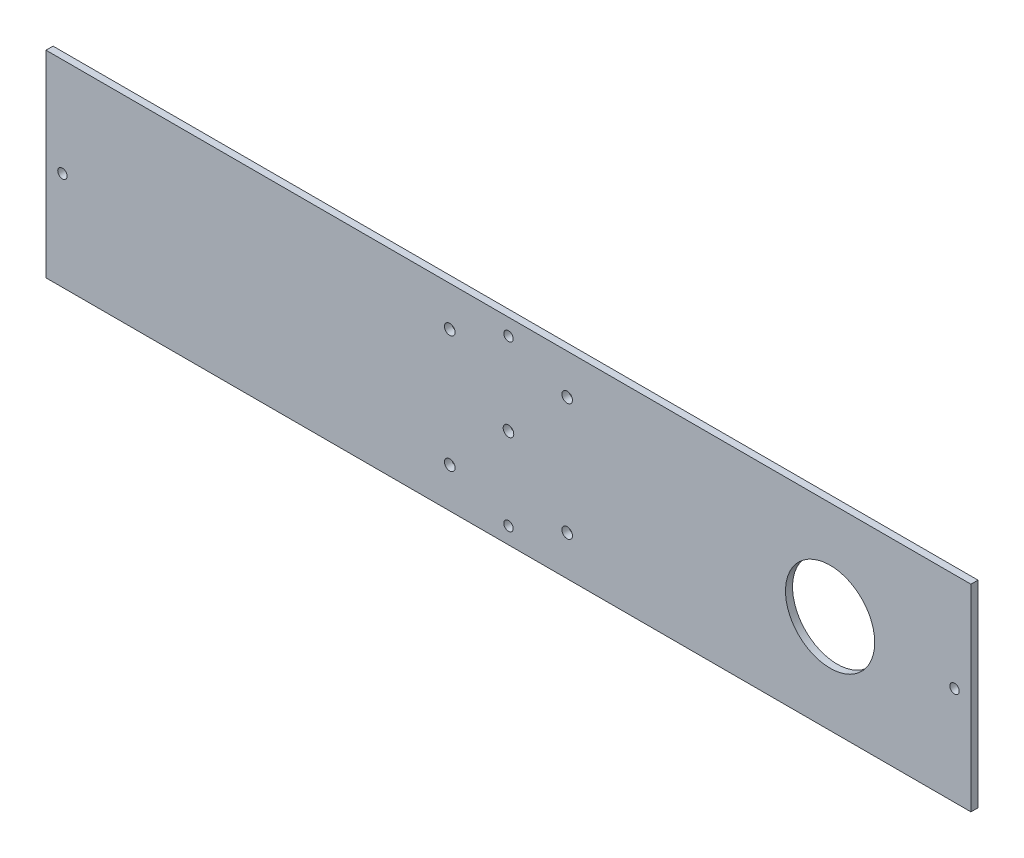
from build123d import *

# Parameters (mm, degrees)
SCHIZZO1_W                   = 394
SCHIZZO1_H                   = 84
SCHIZZO1_R                   = 2
SCHIZZO1_R_2                 = 2.25
SCHIZZO1_R_3                 = 19
ESTRUSIONE_ESTRUSIONE1_DEPTH = 3


with BuildPart() as part:
    # Schizzo1 → Estrusione-Estrusione1 (new body)
    with BuildSketch(Plane.XY):
        with Locations((197, 42)):
            Rectangle(SCHIZZO1_W, SCHIZZO1_H)
        with Locations((7, 42)):
            Circle(SCHIZZO1_R, mode=Mode.SUBTRACT)
        with Locations((197, 77)):
            Circle(SCHIZZO1_R, mode=Mode.SUBTRACT)
        with Locations((197, 7)):
            Circle(SCHIZZO1_R, mode=Mode.SUBTRACT)
        with Locations((387, 42)):
            Circle(SCHIZZO1_R, mode=Mode.SUBTRACT)
        with Locations((197, 42)):
            Circle(SCHIZZO1_R_2, mode=Mode.SUBTRACT)
        with Locations((172, 67)):
            Circle(SCHIZZO1_R_2, mode=Mode.SUBTRACT)
        with Locations((172, 17)):
            Circle(SCHIZZO1_R_2, mode=Mode.SUBTRACT)
        with Locations((222, 17)):
            Circle(SCHIZZO1_R_2, mode=Mode.SUBTRACT)
        with Locations((222, 67)):
            Circle(SCHIZZO1_R_2, mode=Mode.SUBTRACT)
        with Locations((334, 42)):
            Circle(SCHIZZO1_R_3, mode=Mode.SUBTRACT)
    extrude(amount=ESTRUSIONE_ESTRUSIONE1_DEPTH)


solid = part.part
